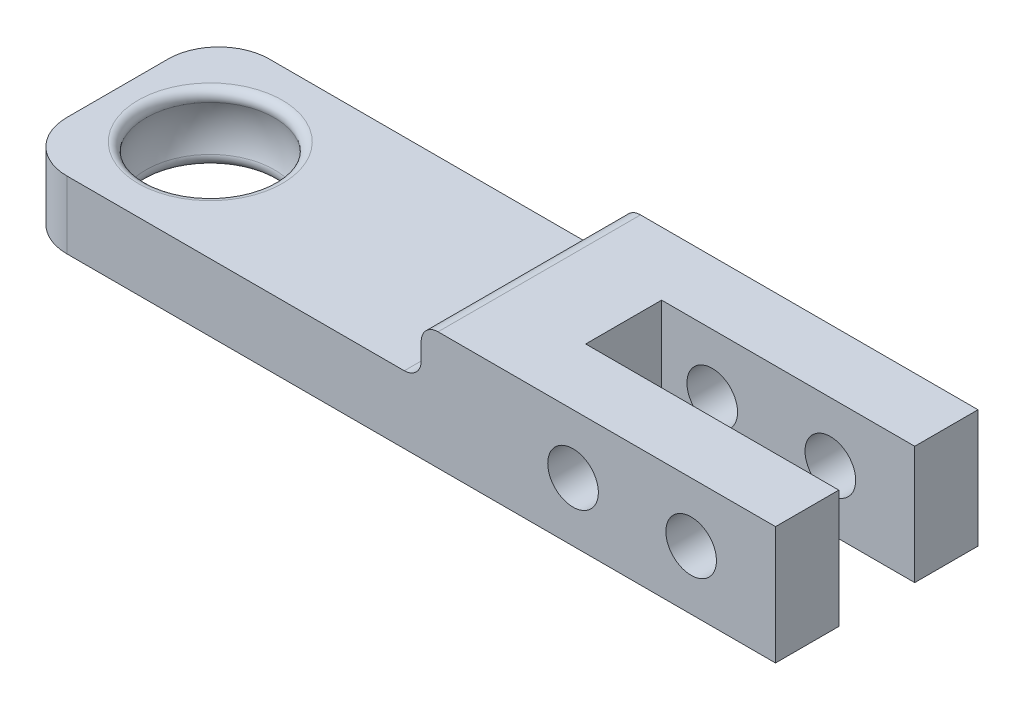
from build123d import *

# Parameters (mm, degrees)
SKETCH1_W               = 45
SKETCH1_H               = 12
BOSS_EXTRUDE1_DEPTH     = 2
FILLET1_R               = 3
FILLET15_R              = 0.5
CUT_EXTRUDE2_DEPTH      = 46.442271187
CUT_EXTRUDE2_DEPTH_BACK = 15
SKETCH11_W              = 4.5
SKETCH11_H              = 4
BOSS_EXTRUDE3_DEPTH     = 3
SKETCH14_R              = 1.5
CUT_EXTRUDE4_DEPTH      = 26.985573053
FILLET17_R              = 1


with BuildPart() as part:
    # Sketch1 → Boss-Extrude1 (new, symmetric)
    with BuildSketch(Plane(origin=(0, 0, 0), x_dir=(1, 0, 0), z_dir=(0, 1, 0))):
        Rectangle(SKETCH1_W, SKETCH1_H)
    extrude(amount=BOSS_EXTRUDE1_DEPTH, both=True)

    # Sketch2 → Cut-Revolve2 (revolve, cut)
    with BuildSketch(Plane.XY):
        with BuildLine():
            Line((-17, 2), (-17, -2))
            Line((-17, -2), (-20.5, -2))
            ThreePointArc((-20.5, -2), (-21.031128874, 0), (-20.5, 2))
            Line((-20.5, 2), (-17, 2))
        make_face()
    revolve(axis=Axis((-17, 2, 0), (0, -1, 0)), mode=Mode.SUBTRACT)

    # Fillet1
    fillet1_edges = [part.edges().sort_by_distance(p)[0] for p in [
        (-22.5, 0, 6),
        (-22.5, 0, -6),
    ]]
    fillet(fillet1_edges, radius=FILLET1_R)

    # Fillet15
    fillet15_edges = [part.edges().sort_by_distance(p)[0] for p in [
        (-13.5, 2, 0),
        (-13.5, -2, 0),
    ]]
    fillet(fillet15_edges, radius=FILLET15_R)

    # Sketch11 → Cut-Extrude2 (cut, two sides: drawn at the far end of the back side and taken through both)
    with BuildSketch(Plane(origin=(22.5, 0, 0), x_dir=(0, 0, -1), z_dir=(1, 0, 0)).offset(-CUT_EXTRUDE2_DEPTH_BACK)):
        Rectangle(SKETCH11_W, SKETCH11_H)
    extrude(amount=CUT_EXTRUDE2_DEPTH + CUT_EXTRUDE2_DEPTH_BACK, mode=Mode.SUBTRACT)

    # Sketch13 → Boss-Extrude3 (add)
    with BuildSketch(Plane(origin=(0, 2, 0), x_dir=(1, 0, 0), z_dir=(0, 1, 0))):
        Polygon((22.5, 2.25), (7.5, 2.25), (7.5, -2.25), (22.5, -2.25), (22.5, -6), (1.5, -6), (1.5, -2.5), (1.5, 2.5), (1.5, 6), (22.5, 6), align=None)
    extrude(amount=BOSS_EXTRUDE3_DEPTH)

    # Sketch14 → Cut-Extrude4 (cut, through all)
    with BuildSketch(Plane(origin=(0, 0, -6), x_dir=(-1, 0, 0), z_dir=(0, 0, -1))):
        with Locations((-17.5, 1.5)):
            Circle(SKETCH14_R)
        with Locations((-10.5, 1.5)):
            Circle(SKETCH14_R)
    extrude(amount=-CUT_EXTRUDE4_DEPTH, mode=Mode.SUBTRACT)

    # Fillet17
    fillet17_edges = [part.edges().sort_by_distance(p)[0] for p in [
        (1.5, 2, 0),
        (1.5, 5, 0),
    ]]
    fillet(fillet17_edges, radius=FILLET17_R)


solid = part.part
